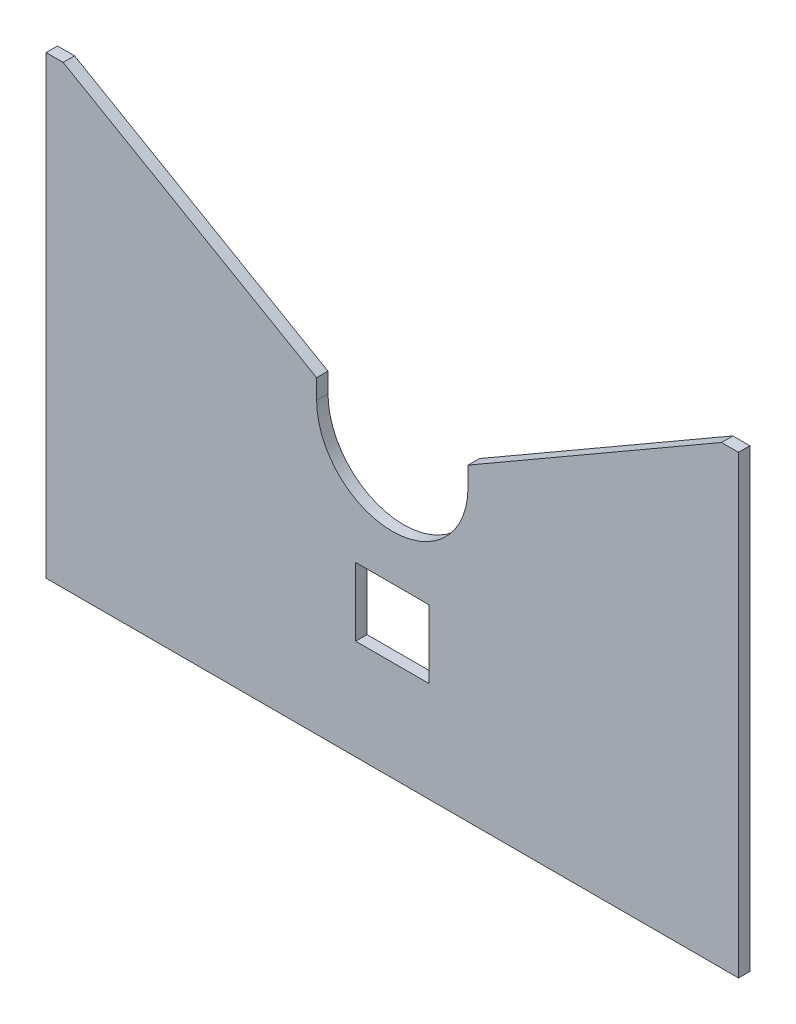
from build123d import *

# Parameters (mm, degrees)
BOSS_EXTRUDE1_DEPTH = 12.7
SKETCH7_W           = 81.817014572
SKETCH7_H           = 76.120378059
CUT_EXTRUDE5_DEPTH  = 12.7


with BuildPart() as part:
    # Sketch1 → Boss-Extrude1 (new body)
    with BuildSketch(Plane.XY.offset(1081.90385267)):
        with BuildLine():
            Line((477.370001613, 579.113460481), (743.688832794, 732.872709354))
            Line((743.688832794, 732.872709354), (760.186616736, 742.397709354))
            Line((760.186616736, 742.397709354), (779.236616736, 742.397709354))
            Line((779.236616736, 742.397709354), (779.236616736, 234.397709354))
            Line((779.236616736, 234.397709354), (6.593386489, 234.397709354))
            Line((6.593386489, 234.397709354), (6.593386489, 742.397709354))
            Line((6.593386489, 742.397709354), (25.643386489, 742.397709354))
            Line((25.643386489, 742.397709354), (42.141170431, 732.872709354))
            Line((42.141170431, 732.872709354), (308.460001613, 579.113460481))
            Line((308.460001613, 579.113460481), (308.460001613, 557.307056284))
            ThreePointArc((308.460001613, 557.307056284), (392.915001613, 472.852056284), (477.370001613, 557.307056284))
            Line((477.370001613, 557.307056284), (477.370001613, 579.113460481))
        make_face()
    extrude(amount=-BOSS_EXTRUDE1_DEPTH)

    # Sketch7 → Cut-Extrude5 (cut)
    with BuildSketch(Plane(origin=(0, 0, 1069.20385267), x_dir=(-1, 0, 0), z_dir=(0, 0, -1))):
        with Locations((-392.915001613, 384.334045895)):
            Rectangle(SKETCH7_W, SKETCH7_H)
    extrude(amount=-CUT_EXTRUDE5_DEPTH, mode=Mode.SUBTRACT)


solid = part.part
